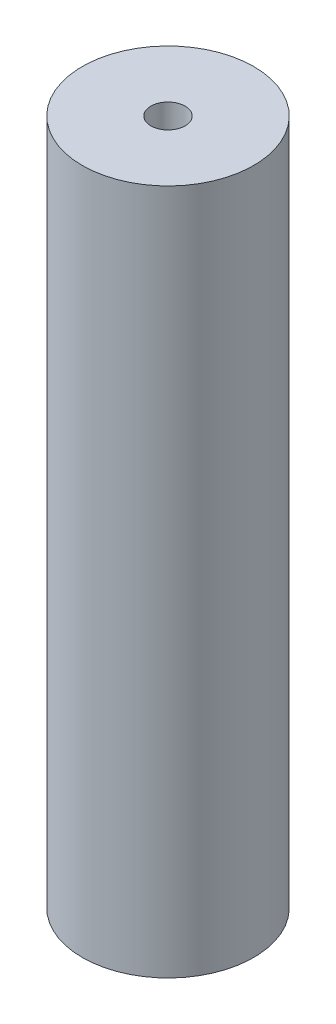
from build123d import *

# Parameters (mm, degrees)
ESQUISSE1_R             = 10
BOSS_EXTRU_1_DEPTH      = 80
ESQUISSE9_R             = 2
ENL_V_MAT_EXTRU_1_DEPTH = 20
ESQUISSE10_R            = 1.505
ENL_V_MAT_EXTRU_2_DEPTH = 15


with BuildPart() as part:
    # Esquisse1 → Boss.-Extru.1 (new body)
    with BuildSketch(Plane(origin=(0, 0, 0), x_dir=(1, 0, 0), z_dir=(0, 1, 0))):
        with Locations(Location((0, 0, 0), (0, 0, 270))):
            Circle(ESQUISSE1_R)
    extrude(amount=BOSS_EXTRU_1_DEPTH)

    # Esquisse9 → Enlèv. mat.-Extru.1 (cut)
    with BuildSketch(Plane(origin=(0, 80, 0), x_dir=(1, 0, 0), z_dir=(0, 1, 0))):
        with Locations(Location((0, 0, 0), (0, 0, 270))):
            Circle(ESQUISSE9_R)
    extrude(amount=-ENL_V_MAT_EXTRU_1_DEPTH, mode=Mode.SUBTRACT)

    # Esquisse10 → Enlèv. mat.-Extru.2 (cut)
    with BuildSketch(Plane(origin=(0, 0, 0), x_dir=(-1, 0, 0), z_dir=(0, -1, 0))):
        with Locations(Location((0, 0, 0), (0, 0, 90))):
            Circle(ESQUISSE10_R)
    extrude(amount=-ENL_V_MAT_EXTRU_2_DEPTH, mode=Mode.SUBTRACT)


solid = part.part
